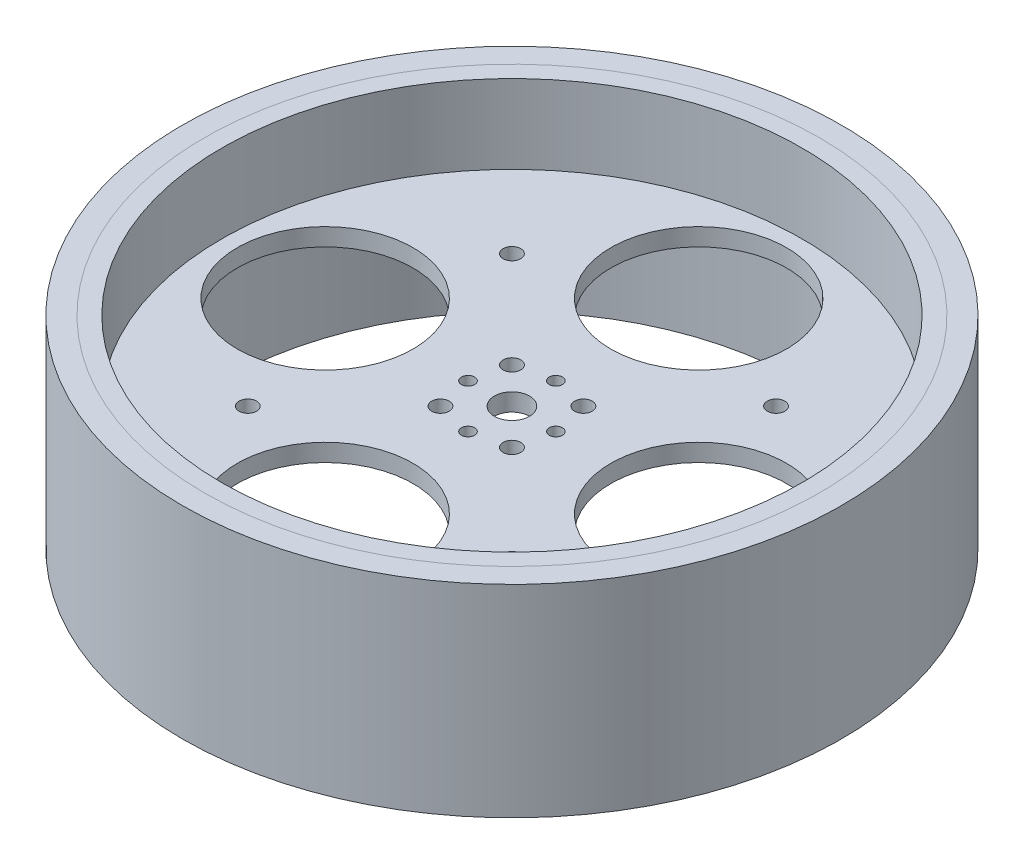
from build123d import *

# Parameters (mm, degrees)
BOSS_EXTRUDE1_DEPTH      = 2
BOSS_EXTRUDE1_DEPTH_BACK = 2
SKETCH1_R                = 66
SKETCH1_R_2              = 2
SKETCH1_R_3              = 20
SKETCH1_R_4              = 1.5
SKETCH1_R_5              = 4
BOSS_EXTRUDE2_DEPTH      = 19.9
BOSS_EXTRUDE2_DEPTH_BACK = 26.1
SKETCH1_3_R              = 70
SKETCH1_3_R_2            = 66
BOSS_EXTRUDE3_DEPTH      = 19.9
BOSS_EXTRUDE3_DEPTH_BACK = 26.1
SKETCH1_4_R              = 75
SKETCH1_4_R_2            = 70


with BuildPart() as part:
    # Sketch1 → Boss-Extrude1 (new, two sides: drawn at the far end of the back side and taken through both)
    with BuildSketch(Plane(origin=(0, 0, 0), x_dir=(1, 0, 0), z_dir=(0, 1, 0)).offset(-BOSS_EXTRUDE1_DEPTH_BACK)):
        Circle(SKETCH1_R)
        with Locations((-30.0520382, -30.0520382)):
            Circle(SKETCH1_R_2, mode=Mode.SUBTRACT)
        with Locations((-8.131667934, -8.131667934)):
            Circle(SKETCH1_R_2, mode=Mode.SUBTRACT)
        with Locations((0, -42.5)):
            Circle(SKETCH1_R_3, mode=Mode.SUBTRACT)
        with Locations((30.0520382, -30.0520382)):
            Circle(SKETCH1_R_2, mode=Mode.SUBTRACT)
        with Locations((0, -10)):
            Circle(SKETCH1_R_4, mode=Mode.SUBTRACT)
        with Locations((8.131667934, -8.131667934)):
            Circle(SKETCH1_R_2, mode=Mode.SUBTRACT)
        with Locations((-42.5, 0)):
            Circle(SKETCH1_R_3, mode=Mode.SUBTRACT)
        with Locations((-10, 0)):
            Circle(SKETCH1_R_4, mode=Mode.SUBTRACT)
        with Locations((-8.131667934, 8.131667934)):
            Circle(SKETCH1_R_2, mode=Mode.SUBTRACT)
        with Locations((-30.0520382, 30.0520382)):
            Circle(SKETCH1_R_2, mode=Mode.SUBTRACT)
        Circle(SKETCH1_R_5, mode=Mode.SUBTRACT)
        with Locations((8.131667934, 8.131667934)):
            Circle(SKETCH1_R_2, mode=Mode.SUBTRACT)
        with Locations((10, 0)):
            Circle(SKETCH1_R_4, mode=Mode.SUBTRACT)
        with Locations((0, 10)):
            Circle(SKETCH1_R_4, mode=Mode.SUBTRACT)
        with Locations((30.0520382, 30.0520382)):
            Circle(SKETCH1_R_2, mode=Mode.SUBTRACT)
        with Locations((42.5, 0)):
            Circle(SKETCH1_R_3, mode=Mode.SUBTRACT)
        with Locations((0, 42.5)):
            Circle(SKETCH1_R_3, mode=Mode.SUBTRACT)
    extrude(amount=BOSS_EXTRUDE1_DEPTH + BOSS_EXTRUDE1_DEPTH_BACK)

    # Sketch1<3> → Boss-Extrude2 (add, two sides: drawn at the far end of the back side and taken through both)
    with BuildSketch(Plane(origin=(0, 0, 0), x_dir=(1, 0, 0), z_dir=(0, 1, 0)).offset(-BOSS_EXTRUDE2_DEPTH_BACK)):
        Circle(SKETCH1_3_R)
        Circle(SKETCH1_3_R_2, mode=Mode.SUBTRACT)
    extrude(amount=BOSS_EXTRUDE2_DEPTH + BOSS_EXTRUDE2_DEPTH_BACK)


with BuildPart() as body_2:
    # Sketch1<4> → Boss-Extrude3 (new, two sides: drawn at the far end of the back side and taken through both)
    with BuildSketch(Plane(origin=(0, 0, 0), x_dir=(1, 0, 0), z_dir=(0, 1, 0)).offset(-BOSS_EXTRUDE3_DEPTH_BACK)):
        Circle(SKETCH1_4_R)
        Circle(SKETCH1_4_R_2, mode=Mode.SUBTRACT)
    extrude(amount=BOSS_EXTRUDE3_DEPTH + BOSS_EXTRUDE3_DEPTH_BACK)


solid = Compound([part.part, body_2.part])
